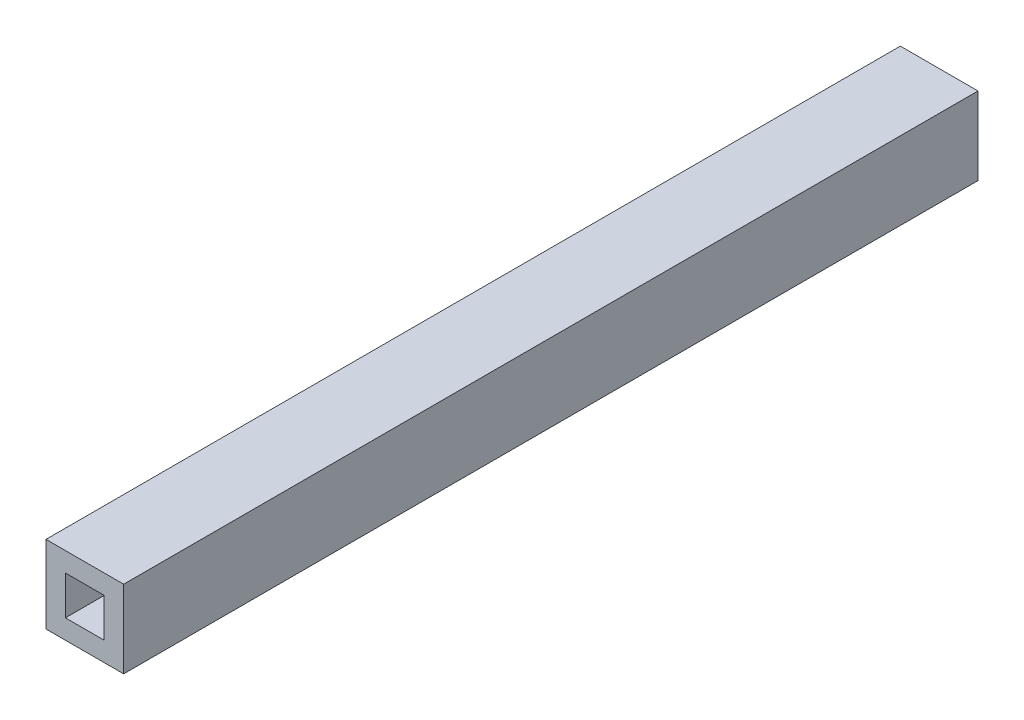
from build123d import *

# Parameters (mm, degrees)
SKETCH1_W           = 20
SKETCH1_H           = 20
SKETCH1_W_2         = 10
SKETCH1_H_2         = 10
EXTRUDE_THIN1_DEPTH = 220


with BuildPart() as part:
    # Sketch1 → Extrude-Thin1 (new body)
    with BuildSketch(Plane.XY):
        Rectangle(SKETCH1_W, SKETCH1_H)
        Rectangle(SKETCH1_W_2, SKETCH1_H_2, mode=Mode.SUBTRACT)
    extrude(amount=EXTRUDE_THIN1_DEPTH)


solid = part.part
